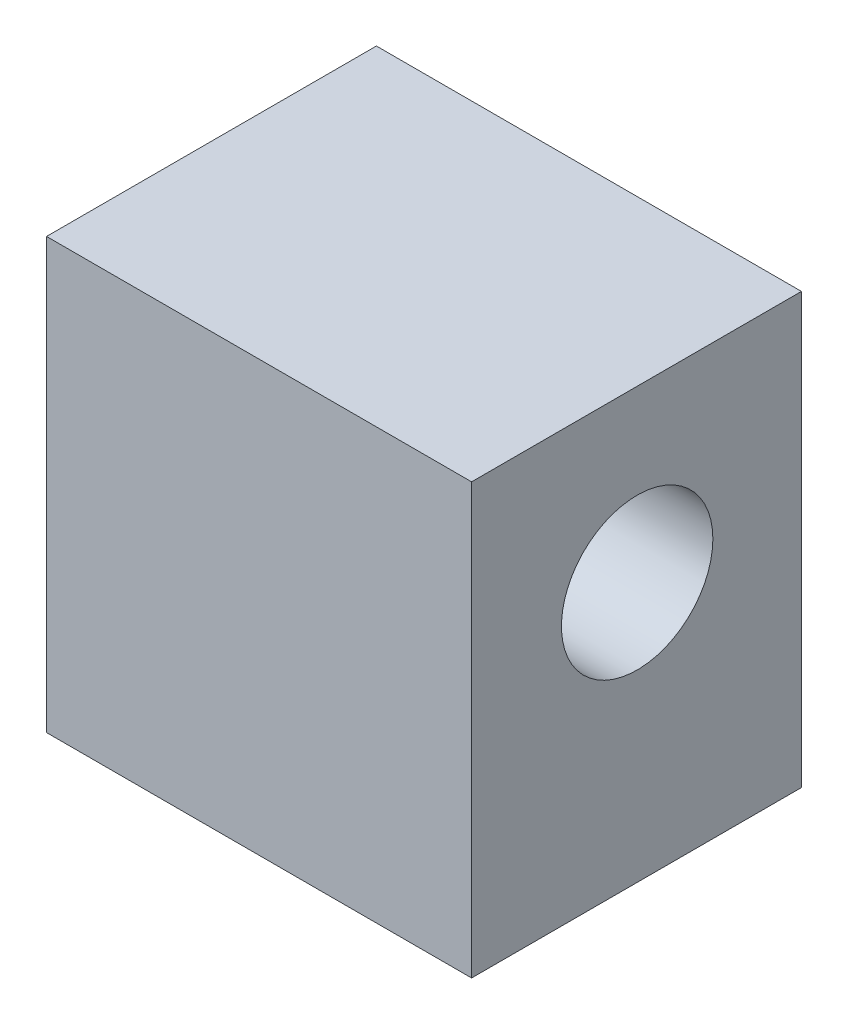
from build123d import *

# Parameters (mm, degrees)
SKETCH1_W           = 193.297663119
SKETCH1_H           = 195.415985989
BOSS_EXTRUDE1_DEPTH = 150
SKETCH2_R           = 34.433059545
CUT_EXTRUDE1_DEPTH  = 300.417607115


with BuildPart() as part:
    # Sketch1 → Boss-Extrude1 (new body)
    with BuildSketch(Plane.XY):
        with Locations((-71.796725803, 74.880873633)):
            Rectangle(SKETCH1_W, SKETCH1_H)
    extrude(amount=BOSS_EXTRUDE1_DEPTH)

    # Sketch2 → Cut-Extrude1 (cut, through all)
    with BuildSketch(Plane(origin=(24.852105757, 0, 0), x_dir=(0, 0, -1), z_dir=(1, 0, 0))):
        with Locations((-74.708195537, 95.259520614)):
            Circle(SKETCH2_R)
    extrude(amount=-CUT_EXTRUDE1_DEPTH, mode=Mode.SUBTRACT)


solid = part.part
